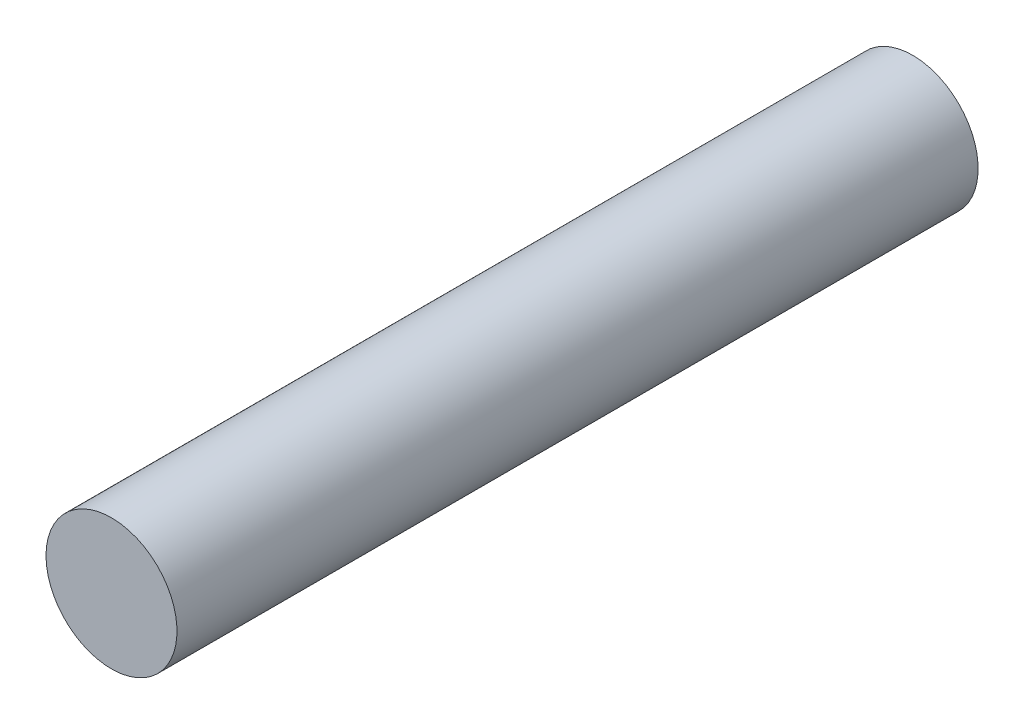
from build123d import *

# Parameters (mm, degrees)
SKETCH1_R           = 2.159
BOSS_EXTRUDE1_DEPTH = 26.416


with BuildPart() as part:
    # Sketch1 → Boss-Extrude1 (new body)
    with BuildSketch(Plane.XY):
        with Locations(Location((0, 0, 0), (0, 0, 180))):
            Circle(SKETCH1_R)
    extrude(amount=BOSS_EXTRUDE1_DEPTH)


solid = part.part
